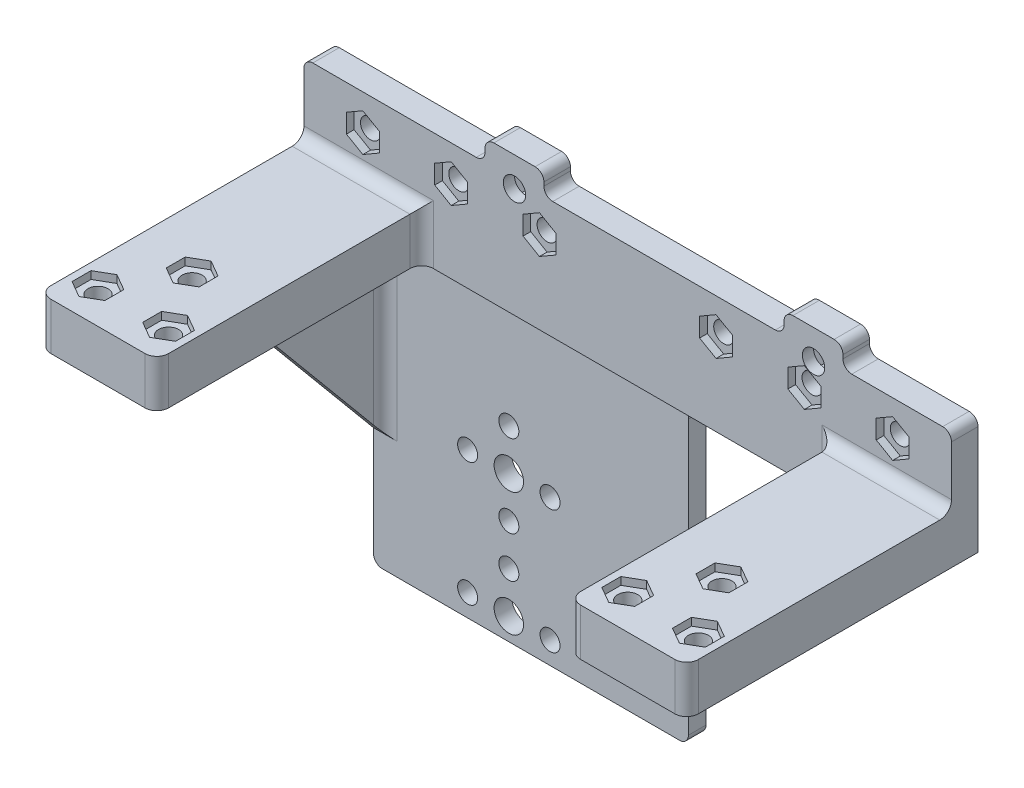
from build123d import *

# Parameters (mm, degrees)
SKETCH_1_W          = 110
SKETCH_1_H          = 20
SKETCH_1_R          = 1.7
EXTRUDE_1_DEPTH     = 4.5
SKETCH_2_W          = 20
SKETCH_2_H          = 8
EXTRUDE_2_DEPTH     = 45
SKETCH_4_W          = 10
SKETCH_4_H          = 10
EXTRUDE_3_DEPTH     = 4.5
SKETCH_5_R          = 1.9
SKETCH_5_R_2        = 1.7
CUT_EXTRUDE_1_DEPTH = 75.885745444
CUT_EXTRUDE_2_DEPTH = 1.3
CUT_EXTRUDE_3_DEPTH = 2.6
SKETCH_7_R          = 1.7
CUT_EXTRUDE_5_DEPTH = 78.673192742
CUT_EXTRUDE_6_DEPTH = 1.3
SKETCH_9_W          = 80
SKETCH_9_H          = 3
EXTRUDE_4_DEPTH     = 50
SKETCH_11_W         = 17.2
SKETCH_11_H         = 50
SKETCH_11_W_2       = 9.3
SKETCH_11_R         = 2.5
SKETCH_11_R_2       = 1.7
CUT_EXTRUDE_7_DEPTH = 90.304255218
RIB_4_REACH         = 124.026
SKETCH_12_WALL_W    = 285.10321006
SKETCH_12_WALL_H    = 2
FILLET_1_R          = 2
FILLET_2_R          = 1.5
FILLET_3_R          = 2


with BuildPart() as part:
    # 草图1 → 凸台-拉伸1 (new body)
    with BuildSketch(Plane.XY):
        with Locations((0, 10)):
            Rectangle(SKETCH_1_W, SKETCH_1_H)
        with Locations((-45, 14)):
            Circle(SKETCH_1_R, mode=Mode.SUBTRACT)
        with Locations((-30, 14)):
            Circle(SKETCH_1_R, mode=Mode.SUBTRACT)
        with Locations((-15, 14)):
            Circle(SKETCH_1_R, mode=Mode.SUBTRACT)
        with Locations((15, 14)):
            Circle(SKETCH_1_R, mode=Mode.SUBTRACT)
        with Locations((30, 14)):
            Circle(SKETCH_1_R, mode=Mode.SUBTRACT)
        with Locations((45, 14)):
            Circle(SKETCH_1_R, mode=Mode.SUBTRACT)
    extrude(amount=EXTRUDE_1_DEPTH)

    # 草图2 → 凸台-拉伸2 (add)
    with BuildSketch(Plane.XY.offset(4.5)):
        with Locations((-45, 4)):
            Rectangle(SKETCH_2_W, SKETCH_2_H)
        with Locations((45, 4)):
            Rectangle(SKETCH_2_W, SKETCH_2_H)
    extrude(amount=EXTRUDE_2_DEPTH)

    # 草图4 → 凸台-拉伸3 (add)
    with BuildSketch(Plane.XY.offset(4.5)):
        with Locations((-19.238259457, 18.6193749)):
            Rectangle(SKETCH_4_W, SKETCH_4_H)
        with Locations((31.561740543, 18.6193749)):
            Rectangle(SKETCH_4_W, SKETCH_4_H)
    extrude(amount=-EXTRUDE_3_DEPTH)

    # 草图5 → 切除-拉伸1 (cut, through all)
    with BuildSketch(Plane.XY.offset(4.5)):
        with Locations((-19.238259457, 18.6193749)):
            Circle(SKETCH_5_R)
        with Locations((31.561740543, 18.6193749)):
            Circle(SKETCH_5_R)
        with Locations((-15, 14)):
            Circle(SKETCH_5_R_2)
        with Locations((30, 14)):
            Circle(SKETCH_5_R_2)
    extrude(amount=-CUT_EXTRUDE_1_DEPTH, mode=Mode.SUBTRACT)

    # 草图3 → 切除-拉伸2 (cut)
    with BuildSketch(Plane.XY.offset(4.5)):
        Polygon((-45, 17.22), (-47.7886018, 15.61), (-47.7886018, 12.39), (-45, 10.78), (-42.2113982, 12.39), (-42.2113982, 15.61), align=None)
        Polygon((-30, 17.22), (-32.7886018, 15.61), (-32.7886018, 12.39), (-30, 10.78), (-27.2113982, 12.39), (-27.2113982, 15.61), align=None)
        Polygon((-15, 17.22), (-17.7886018, 15.61), (-17.7886018, 12.39), (-15, 10.78), (-12.2113982, 12.39), (-12.2113982, 15.61), align=None)
        Polygon((15, 17.22), (12.2113982, 15.61), (12.2113982, 12.39), (15, 10.78), (17.7886018, 12.39), (17.7886018, 15.61), align=None)
        Polygon((30, 17.22), (27.2113982, 15.61), (27.2113982, 12.39), (30, 10.78), (32.7886018, 12.39), (32.7886018, 15.61), align=None)
        Polygon((45, 17.22), (42.2113982, 15.61), (42.2113982, 12.39), (45, 10.78), (47.7886018, 12.39), (47.7886018, 15.61), align=None)
    extrude(amount=-CUT_EXTRUDE_2_DEPTH, mode=Mode.SUBTRACT)

    # 草图6 → 切除-拉伸3 (cut)
    with BuildSketch(Plane(origin=(0, 0, 0), x_dir=(-1, 0, 0), z_dir=(0, 0, -1))):
        Polygon((-34.861740543, 18.6193749), (-33.211740543, 15.761491068), (-29.911740543, 15.761491068), (-28.261740543, 18.6193749), (-29.911740543, 21.477258733), (-33.211740543, 21.477258733), align=None)
        Polygon((15.938259457, 18.6193749), (17.588259457, 15.761491068), (20.888259457, 15.761491068), (22.538259457, 18.6193749), (20.888259457, 21.477258733), (17.588259457, 21.477258733), align=None)
    extrude(amount=-CUT_EXTRUDE_3_DEPTH, mode=Mode.SUBTRACT)

    # 草图7 → 切除-拉伸5 (cut, through all)
    with BuildSketch(Plane.XZ):
        with Locations(Location((-51, 43.5, 0), (0, 0, 270))):
            Circle(SKETCH_7_R)
        with Locations(Location((-39, 43.5, 0), (0, 0, 270))):
            Circle(SKETCH_7_R)
        with Locations(Location((-45, 33.5, 0), (0, 0, 270))):
            Circle(SKETCH_7_R)
        with Locations(Location((51, 43.5, 0), (0, 0, 270))):
            Circle(SKETCH_7_R)
        with Locations(Location((39, 43.5, 0), (0, 0, 270))):
            Circle(SKETCH_7_R)
        with Locations(Location((45, 33.5, 0), (0, 0, 270))):
            Circle(SKETCH_7_R)
    extrude(amount=-CUT_EXTRUDE_5_DEPTH, mode=Mode.SUBTRACT)

    # 草图8 → 切除-拉伸6 (cut)
    with BuildSketch(Plane(origin=(0, 8, 0), x_dir=(1, 0, 0), z_dir=(0, 1, 0))):
        Polygon((51, -46.72), (53.7886018, -45.11), (53.7886018, -41.89), (51, -40.28), (48.2113982, -41.89), (48.2113982, -45.11), align=None)
        Polygon((39, -46.72), (41.7886018, -45.11), (41.7886018, -41.89), (39, -40.28), (36.2113982, -41.89), (36.2113982, -45.11), align=None)
        Polygon((45, -36.72), (47.7886018, -35.11), (47.7886018, -31.89), (45, -30.28), (42.2113982, -31.89), (42.2113982, -35.11), align=None)
        Polygon((-39, -46.72), (-36.2113982, -45.11), (-36.2113982, -41.89), (-39, -40.28), (-41.7886018, -41.89), (-41.7886018, -45.11), align=None)
        Polygon((-51, -46.72), (-48.2113982, -45.11), (-48.2113982, -41.89), (-51, -40.28), (-53.7886018, -41.89), (-53.7886018, -45.11), align=None)
        Polygon((-45, -36.72), (-42.2113982, -35.11), (-42.2113982, -31.89), (-45, -30.28), (-47.7886018, -31.89), (-47.7886018, -35.11), align=None)
    extrude(amount=-CUT_EXTRUDE_6_DEPTH, mode=Mode.SUBTRACT)

    # 草图9 → 凸台-拉伸4 (add)
    with BuildSketch(Plane.XZ):
        with Locations((-14, 1.5)):
            Rectangle(SKETCH_9_W, SKETCH_9_H)
    extrude(amount=EXTRUDE_4_DEPTH)

    # 草图11 → 切除-拉伸7 (cut, through all)
    with BuildSketch(Plane(origin=(0, 0, 0), x_dir=(-1, 0, 0), z_dir=(0, 0, -1))):
        with Locations((-17.4, -25)):
            Rectangle(SKETCH_11_W, SKETCH_11_H)
        with Locations((49.35, -25)):
            Rectangle(SKETCH_11_W_2, SKETCH_11_H)
        with Locations((21.7, -46.25)):
            Circle(SKETCH_11_R)
        with Locations((14.7, -46.25)):
            Circle(SKETCH_11_R_2)
        with Locations((28.7, -46.25)):
            Circle(SKETCH_11_R_2)
        with Locations((21.7, -39.25)):
            Circle(SKETCH_11_R_2)
        with Locations((21.7, -32.25)):
            Circle(SKETCH_11_R_2)
        with Locations((14.7, -25.25)):
            Circle(SKETCH_11_R_2)
        with Locations((21.7, -18.25)):
            Circle(SKETCH_11_R_2)
        with Locations((28.7, -25.25)):
            Circle(SKETCH_11_R_2)
        with Locations((21.7, -25.25)):
            Circle(SKETCH_11_R)
        with Locations((4.2, -35.75)):
            Circle(SKETCH_11_R_2)
    extrude(amount=-CUT_EXTRUDE_7_DEPTH, mode=Mode.SUBTRACT)

    # 草图12 wall → 筋4 (add, up to next)
    with BuildSketch(Plane(origin=(-44.7, -15, 15.5), x_dir=(0, 0.768221279597, 0.640184399664), z_dir=(0, 0.640184399664, -0.768221279597)), mode=Mode.PRIVATE) as rib_4_sk1:
        with Locations((0, 1)):
            Rectangle(SKETCH_12_WALL_W, SKETCH_12_WALL_H)
    rib_4_tool1 = extrude(rib_4_sk1.sketch, amount=RIB_4_REACH, mode=Mode.PRIVATE) - part.part
    add(rib_4_tool1.solids().sort_by_distance((-44.7, -15, 15.5))[0])

    # 圆角1
    fillet_1_edges = [part.edges().sort_by_distance(p)[0] for p in [
        (-35, 4, 4.5),
        (-45, 8, 4.5),
        (45, 8, 4.5),
        (35, 4, 4.5),
        (8.8, 0, 1.5),
        (-44.7, 0, 14),
        (-42.7, -15, 3),
        (-42.7, 0, 15.5),
    ]]
    fillet(fillet_1_edges, radius=FILLET_1_R)

    # 圆角2
    fillet_2_edges = [part.edges().sort_by_distance(p)[0] for p in [
        (-44.7, -50, 1.5),
        (8.8, -50, 1.5),
        (-24.238259457, 20, 2.25),
        (-14.238259457, 23.6193749, 2.25),
        (-14.238259457, 20, 2.25),
        (-24.238259457, 23.6193749, 2.25),
        (-55, 20, 2.25),
        (55, 20, 2.25),
        (36.561740543, 23.6193749, 2.25),
        (36.561740543, 20, 2.25),
        (26.561740543, 20, 2.25),
        (26.561740543, 23.6193749, 2.25),
    ]]
    fillet(fillet_2_edges, radius=FILLET_2_R)

    # 圆角3
    fillet_3_edges = [part.edges().sort_by_distance(p)[0] for p in [
        (-55, 4, 49.5),
        (-35, 4, 49.5),
        (55, 4, 49.5),
        (35, 4, 49.5),
    ]]
    fillet(fillet_3_edges, radius=FILLET_3_R)


solid = part.part
